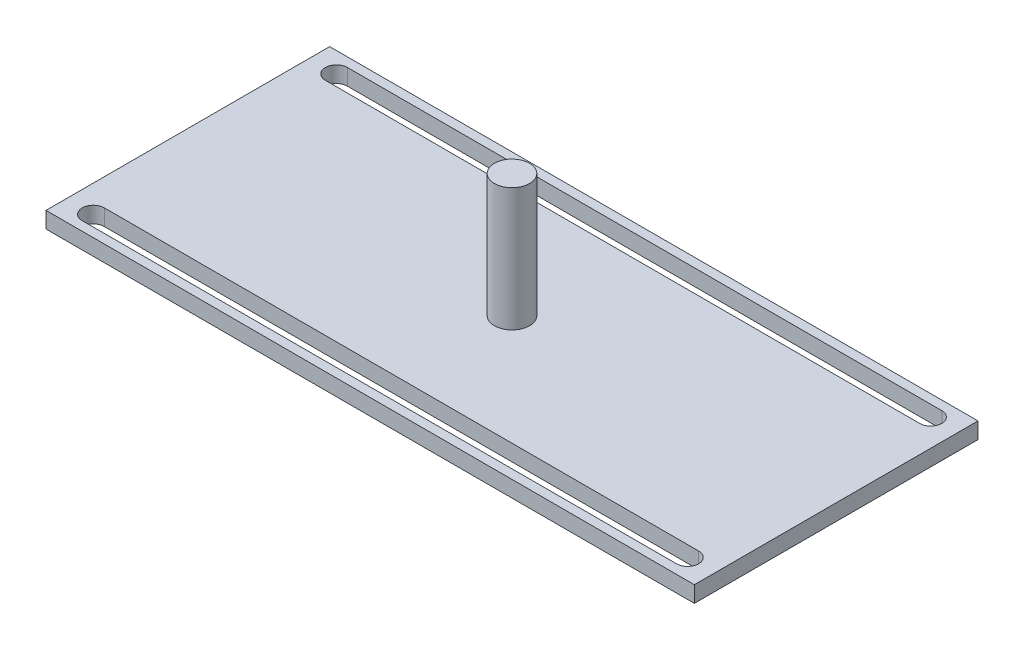
from build123d import *

# Parameters (mm, degrees)
SKETCH_2_W                       = 240
SKETCH_2_H                       = 105
EXTRUDE_1_DEPTH                  = 6
SKETCH_22_R                      = 4.1
CUT_EXTRUDE_3_DEPTH              = 223.650914893
PATTERN_LINEAR_2_COUNT           = 5
PATTERN_LINEAR_2_PITCH           = 55
PATTERN_LINEAR_3_COPY_1_SKETCH_R = 4.1
PATTERN_LINEAR_3_COPY_1_DEPTH    = 223.650914893
PATTERN_LINEAR_3_COPY_2_SKETCH_R = 4.1
PATTERN_LINEAR_3_COPY_2_DEPTH    = 223.650914893
PATTERN_LINEAR_3_COPY_3_SKETCH_R = 4.1
PATTERN_LINEAR_3_COPY_3_DEPTH    = 223.650914893
PATTERN_LINEAR_3_COPY_4_SKETCH_R = 4.1
PATTERN_LINEAR_3_COPY_4_DEPTH    = 223.650914893
PATTERN_LINEAR_3_COPY_5_SKETCH_R = 4.1
PATTERN_LINEAR_3_COPY_5_DEPTH    = 223.650914893
PATTERN_LINEAR_3_COPY_6_SKETCH_R = 4.1
PATTERN_LINEAR_3_COPY_6_DEPTH    = 223.650914893
PATTERN_LINEAR_3_COPY_7_SKETCH_R = 4.1
PATTERN_LINEAR_3_COPY_7_DEPTH    = 223.650914893
PATTERN_LINEAR_3_COPY_8_SKETCH_R = 4.1
PATTERN_LINEAR_3_COPY_8_DEPTH    = 223.650914893
SKETCH_18_R                      = 6.5
EXTRUDE_5_DEPTH                  = 45.6
SKETCH_25_W                      = 110
SKETCH_25_H                      = 8.2
CUT_EXTRUDE_4_DEPTH              = 229.473171078
MIRROR_27_COPY_1_SKETCH_W        = 110
MIRROR_27_COPY_1_SKETCH_H        = 8.2
MIRROR_27_COPY_1_DEPTH           = 229.473171078
MIRROR_27_COPY_2_SKETCH_W        = 110
MIRROR_27_COPY_2_SKETCH_H        = 8.2
MIRROR_27_COPY_2_DEPTH           = 229.473171078


with BuildPart() as part:
    # 草图2 → 凸台-拉伸1 (new body)
    with BuildSketch(Plane(origin=(0, 0, 0), x_dir=(1, 0, 0), z_dir=(0, 1, 0))):
        with Locations((-85.476378725, 33.038808084)):
            Rectangle(SKETCH_2_W, SKETCH_2_H)
    extrude(amount=EXTRUDE_1_DEPTH)

    # 草图22 → 切除-拉伸3 (cut, through all)
    with BuildSketch(Plane(origin=(0, 0, 0), x_dir=(1, 0, 0), z_dir=(0, 1, 0))):
        with Locations(Location((-195.476378725, 78.038808084, 0), (0, 0, 270))):
            Circle(SKETCH_22_R)
    cut_extrude_3 = extrude(amount=CUT_EXTRUDE_3_DEPTH, mode=Mode.SUBTRACT)

    # 镜向18: 切除-拉伸3 across plane
    add(cut_extrude_3.mirror(Plane.XY.offset(-33.038808084)), mode=Mode.SUBTRACT)

    # 阵列(线性)2: 切除-拉伸3 ×5
    with Locations(*[(i * PATTERN_LINEAR_2_PITCH, 0, 0) for i in range(1, PATTERN_LINEAR_2_COUNT)]):
        add(cut_extrude_3, mode=Mode.SUBTRACT)

    # 阵列(线性)3 copy 1 sketch → 阵列(线性)3 copy 1 (cut, through all)
    with BuildSketch(Plane(origin=(55, 0, -66.077616169), x_dir=(1, 0, 0), z_dir=(0, 1, 0))):
        with Locations((-195.476378725, -78.038808084)):
            Circle(PATTERN_LINEAR_3_COPY_1_SKETCH_R)
    extrude(amount=PATTERN_LINEAR_3_COPY_1_DEPTH, mode=Mode.SUBTRACT)

    # 阵列(线性)3 copy 2 sketch → 阵列(线性)3 copy 2 (cut, through all)
    with BuildSketch(Plane(origin=(110, 0, -66.077616169), x_dir=(1, 0, 0), z_dir=(0, 1, 0))):
        with Locations((-195.476378725, -78.038808084)):
            Circle(PATTERN_LINEAR_3_COPY_2_SKETCH_R)
    extrude(amount=PATTERN_LINEAR_3_COPY_2_DEPTH, mode=Mode.SUBTRACT)

    # 阵列(线性)3 copy 3 sketch → 阵列(线性)3 copy 3 (cut, through all)
    with BuildSketch(Plane(origin=(165, 0, -66.077616169), x_dir=(1, 0, 0), z_dir=(0, 1, 0))):
        with Locations((-195.476378725, -78.038808084)):
            Circle(PATTERN_LINEAR_3_COPY_3_SKETCH_R)
    extrude(amount=PATTERN_LINEAR_3_COPY_3_DEPTH, mode=Mode.SUBTRACT)

    # 阵列(线性)3 copy 4 sketch → 阵列(线性)3 copy 4 (cut, through all)
    with BuildSketch(Plane(origin=(220, 0, -66.077616169), x_dir=(1, 0, 0), z_dir=(0, 1, 0))):
        with Locations((-195.476378725, -78.038808084)):
            Circle(PATTERN_LINEAR_3_COPY_4_SKETCH_R)
    extrude(amount=PATTERN_LINEAR_3_COPY_4_DEPTH, mode=Mode.SUBTRACT)

    # 阵列(线性)3 copy 5 sketch → 阵列(线性)3 copy 5 (cut, through all)
    with BuildSketch(Plane(origin=(55, 0, 0), x_dir=(1, 0, 0), z_dir=(0, 1, 0))):
        with Locations(Location((-195.476378725, 78.038808084, 0), (0, 0, 270))):
            Circle(PATTERN_LINEAR_3_COPY_5_SKETCH_R)
    extrude(amount=PATTERN_LINEAR_3_COPY_5_DEPTH, mode=Mode.SUBTRACT)

    # 阵列(线性)3 copy 6 sketch → 阵列(线性)3 copy 6 (cut, through all)
    with BuildSketch(Plane(origin=(110, 0, 0), x_dir=(1, 0, 0), z_dir=(0, 1, 0))):
        with Locations(Location((-195.476378725, 78.038808084, 0), (0, 0, 270))):
            Circle(PATTERN_LINEAR_3_COPY_6_SKETCH_R)
    extrude(amount=PATTERN_LINEAR_3_COPY_6_DEPTH, mode=Mode.SUBTRACT)

    # 阵列(线性)3 copy 7 sketch → 阵列(线性)3 copy 7 (cut, through all)
    with BuildSketch(Plane(origin=(165, 0, 0), x_dir=(1, 0, 0), z_dir=(0, 1, 0))):
        with Locations(Location((-195.476378725, 78.038808084, 0), (0, 0, 270))):
            Circle(PATTERN_LINEAR_3_COPY_7_SKETCH_R)
    extrude(amount=PATTERN_LINEAR_3_COPY_7_DEPTH, mode=Mode.SUBTRACT)

    # 阵列(线性)3 copy 8 sketch → 阵列(线性)3 copy 8 (cut, through all)
    with BuildSketch(Plane(origin=(220, 0, 0), x_dir=(1, 0, 0), z_dir=(0, 1, 0))):
        with Locations(Location((-195.476378725, 78.038808084, 0), (0, 0, 270))):
            Circle(PATTERN_LINEAR_3_COPY_8_SKETCH_R)
    extrude(amount=PATTERN_LINEAR_3_COPY_8_DEPTH, mode=Mode.SUBTRACT)

    # 草图18 → 凸台-拉伸5 (add)
    with BuildSketch(Plane(origin=(0, 6, 0), x_dir=(1, 0, 0), z_dir=(0, 1, 0))):
        with Locations(Location((-85.476378725, 33.038808084, 0), (0, 0, 270))):
            Circle(SKETCH_18_R)
    extrude(amount=EXTRUDE_5_DEPTH)

    # 草图25 → 切除-拉伸4 (cut, through all)
    with BuildSketch(Plane(origin=(0, 0, 0), x_dir=(1, 0, 0), z_dir=(0, 1, 0))):
        with Locations((-140.476378725, 78.038808084)):
            Rectangle(SKETCH_25_W, SKETCH_25_H)
    cut_extrude_4 = extrude(amount=CUT_EXTRUDE_4_DEPTH, mode=Mode.SUBTRACT)

    # 镜向25: 切除-拉伸4 across plane
    add(cut_extrude_4.mirror(Plane.XY.offset(-33.038808084)), mode=Mode.SUBTRACT)

    # 镜向26: 切除-拉伸4 across plane
    add(cut_extrude_4.mirror(Plane(origin=(-85.476378725, 0, 0), x_dir=(0, 0, 1), z_dir=(1, 0, 0))), mode=Mode.SUBTRACT)

    # 镜向27 copy 1 sketch → 镜向27 copy 1 (cut, through all)
    with BuildSketch(Plane(origin=(-170.95275745, 0, -66.077616169), x_dir=(-1, 0, 0), z_dir=(0, 1, 0))):
        with Locations((-140.476378725, 78.038808084)):
            Rectangle(MIRROR_27_COPY_1_SKETCH_W, MIRROR_27_COPY_1_SKETCH_H)
    extrude(amount=MIRROR_27_COPY_1_DEPTH, mode=Mode.SUBTRACT)

    # 镜向27 copy 2 sketch → 镜向27 copy 2 (cut, through all)
    with BuildSketch(Plane(origin=(-170.95275745, 0, 0), x_dir=(-1, 0, 0), z_dir=(0, 1, 0))):
        with Locations((-140.476378725, -78.038808084)):
            Rectangle(MIRROR_27_COPY_2_SKETCH_W, MIRROR_27_COPY_2_SKETCH_H)
    extrude(amount=MIRROR_27_COPY_2_DEPTH, mode=Mode.SUBTRACT)


solid = part.part
